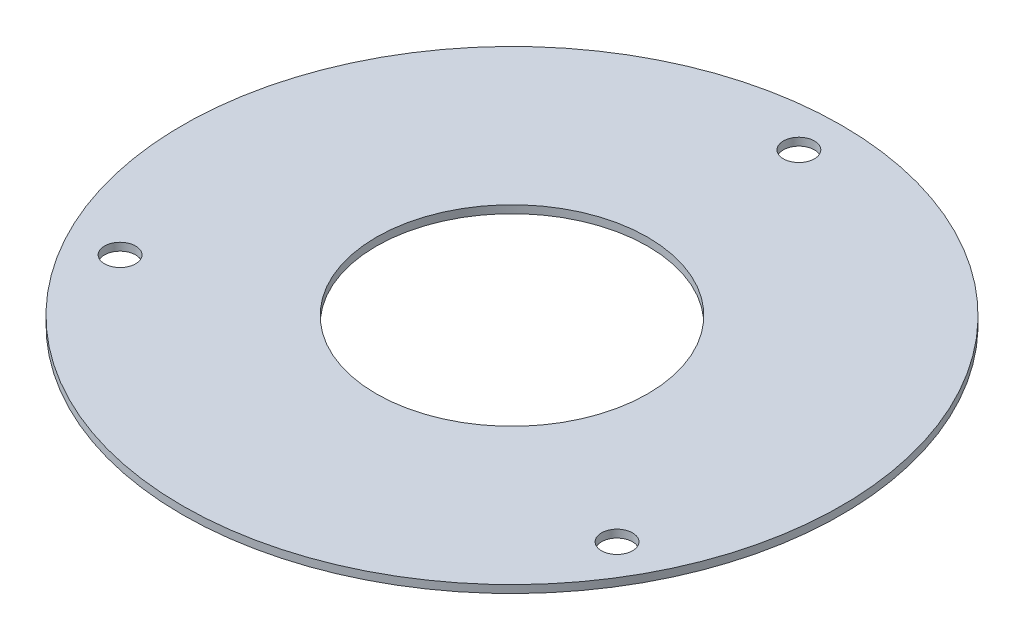
from build123d import *

# Parameters (mm, degrees)
SKETCH1_R           = 42.5
SKETCH1_R_2         = 17.5
SKETCH1_R_3         = 2
BOSS_EXTRUDE1_DEPTH = 1


with BuildPart() as part:
    # Sketch1 → Boss-Extrude1 (new body)
    with BuildSketch(Plane(origin=(0, 0, 0), x_dir=(1, 0, 0), z_dir=(0, 1, 0))):
        with Locations(Location((0, 0, 0), (0, 0, 270))):
            Circle(SKETCH1_R)
        with Locations(Location((0, 0, 0), (0, 0, 270))):
            Circle(SKETCH1_R_2, mode=Mode.SUBTRACT)
        with Locations(Location((0, 37, 0), (0, 0, 270))):
            Circle(SKETCH1_R_3, mode=Mode.SUBTRACT)
        with Locations(Location((32.04293994, -18.5, 0), (0, 0, 270))):
            Circle(SKETCH1_R_3, mode=Mode.SUBTRACT)
        with Locations(Location((-32.04293994, -18.5, 0), (0, 0, 270))):
            Circle(SKETCH1_R_3, mode=Mode.SUBTRACT)
    extrude(amount=BOSS_EXTRUDE1_DEPTH)


solid = part.part
